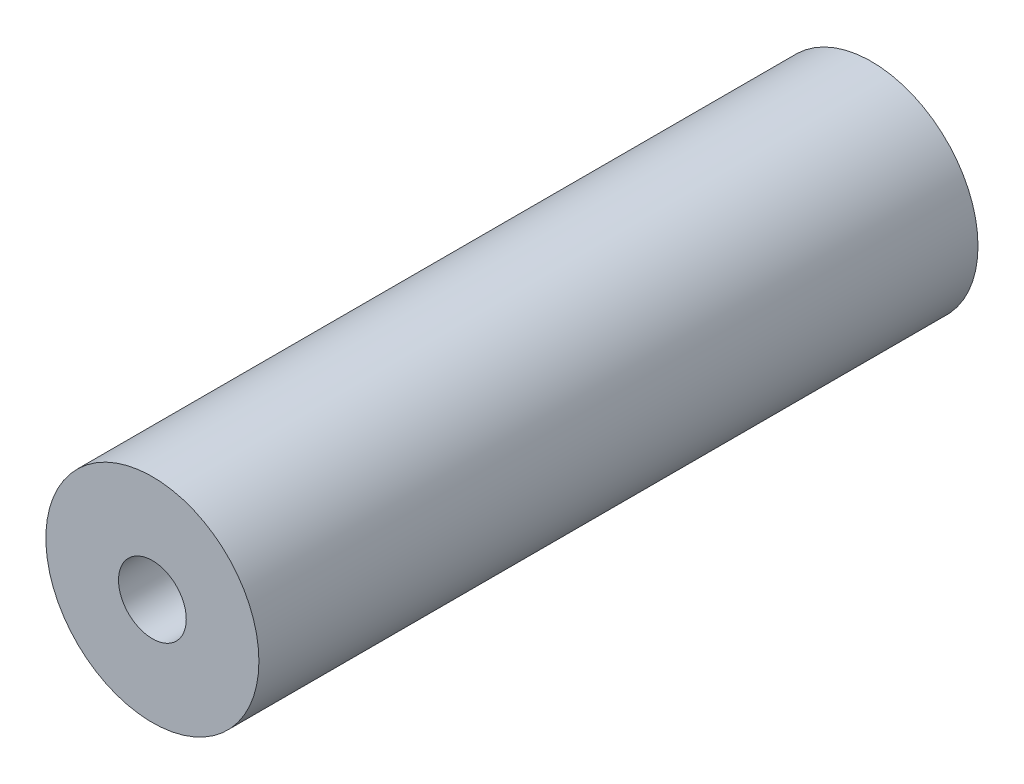
from build123d import *

# Parameters (mm, degrees)
SKETCH1_R                            = 6.35
BOSS_EXTRUDE1_DEPTH                  = 21.43125
F_10_32_TAPPED_HOLE1_D               = 4.0386
F_10_32_TAPPED_HOLE1_DEPTH           = 12.02944
F_10_32_TAPPED_HOLE1_TIP             = 1.213317848
F_10_32_TAPPED_HOLE1_ON_FACE_2_D     = 4.0386
F_10_32_TAPPED_HOLE1_ON_FACE_2_DEPTH = 12.02944
F_10_32_TAPPED_HOLE1_ON_FACE_2_TIP   = 1.213317848


with BuildPart() as part:
    # Sketch1 → Boss-Extrude1 (new, symmetric)
    with BuildSketch(Plane.XY):
        Circle(SKETCH1_R)
    extrude(amount=BOSS_EXTRUDE1_DEPTH, both=True)

    # #10-32 Tapped Hole1
    with Locations(Plane.XY.offset(21.43125)):
        with Locations((0, 0)):
            Hole(F_10_32_TAPPED_HOLE1_D / 2, depth=F_10_32_TAPPED_HOLE1_DEPTH)
            with Locations((0, 0, -(F_10_32_TAPPED_HOLE1_DEPTH + F_10_32_TAPPED_HOLE1_TIP / 2))):  # 118° drill point
                Cone(0, F_10_32_TAPPED_HOLE1_D / 2, F_10_32_TAPPED_HOLE1_TIP, mode=Mode.SUBTRACT)

    # #10-32 Tapped Hole1 on face 2
    with Locations(Plane(origin=(0, 0, -21.43125), x_dir=(-1, 0, 0), z_dir=(0, 0, -1))):
        with Locations((0, 0)):
            Hole(F_10_32_TAPPED_HOLE1_ON_FACE_2_D / 2, depth=F_10_32_TAPPED_HOLE1_ON_FACE_2_DEPTH)
            with Locations((0, 0, -(F_10_32_TAPPED_HOLE1_ON_FACE_2_DEPTH + F_10_32_TAPPED_HOLE1_ON_FACE_2_TIP / 2))):  # 118° drill point
                Cone(0, F_10_32_TAPPED_HOLE1_ON_FACE_2_D / 2, F_10_32_TAPPED_HOLE1_ON_FACE_2_TIP, mode=Mode.SUBTRACT)


solid = part.part
